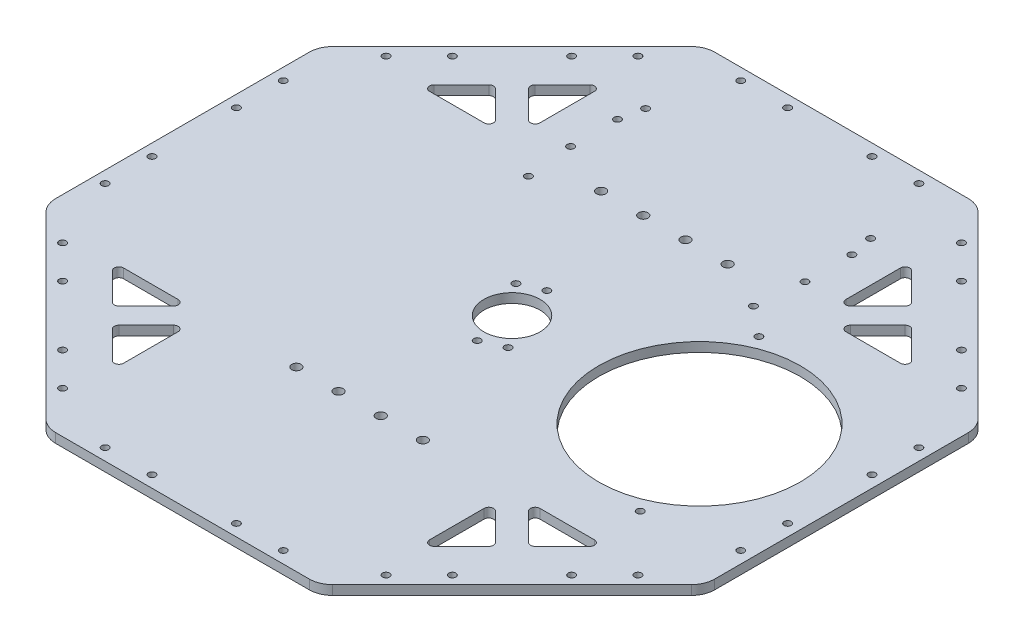
from build123d import *

# Parameters (mm, degrees)
SKETCH_1_R          = 12
SKETCH_1_R_2        = 1.5
EXTRUDE_1_DEPTH     = 4
SKETCH_2_R          = 1.5
SKETCH_2_R_2        = 43
CUT_EXTRUDE_1_DEPTH = 10
SKETCH_3_R          = 1.5
SKETCH_3_R_2        = 2
CUT_EXTRUDE_2_DEPTH = 10
FILLET_3_R          = 10
SKETCH_4_R          = 1.5
CUT_EXTRUDE_3_DEPTH = 10
CUT_EXTRUDE_4_DEPTH = 10
FILLET_4_R          = 2


with BuildPart() as part:
    # 草图1 → 凸台-拉伸1 (new body)
    with BuildSketch(Plane(origin=(0, 0, 0), x_dir=(1, 0, 0), z_dir=(0, 1, 0))):
        Polygon((-140.581929877, 58.23094198), (-58.23094198, 140.581929877), (58.23094198, 140.581929877), (140.581929877, 58.23094198), (140.581929877, -58.23094198), (58.23094198, -140.581929877), (-58.23094198, -140.581929877), (-140.581929877, -58.23094198), align=None)
        with Locations(Location((0, 0, 0), (0, 0, 270))):
            Circle(SKETCH_1_R, mode=Mode.SUBTRACT)
        with Locations(Location((-10.981465686, 12.664726672, 0), (0, 0, 270))):
            Circle(SKETCH_1_R_2, mode=Mode.SUBTRACT)
        with Locations(Location((-1.818534314, 16.663757776, 0), (0, 0, 90))):
            Circle(SKETCH_1_R_2, mode=Mode.SUBTRACT)
        with Locations(Location((1.818534314, -16.663757776, 0), (0, 0, 90))):
            Circle(SKETCH_1_R_2, mode=Mode.SUBTRACT)
        with Locations(Location((10.981465686, -12.664726672, 0), (0, 0, 270))):
            Circle(SKETCH_1_R_2, mode=Mode.SUBTRACT)
    extrude(amount=EXTRUDE_1_DEPTH)

    # 草图2 → 切除-拉伸1 (cut)
    with BuildSketch(Plane(origin=(0, 4, 0), x_dir=(1, 0, 0), z_dir=(0, 1, 0))):
        with Locations(Location((60.4, 44.909241811, 0), (0, 0, 270))):
            Circle(SKETCH_2_R)
        with Locations(Location((99.6, -44.909241811, 0), (0, 0, 270))):
            Circle(SKETCH_2_R)
        with Locations(Location((80, 0, 0), (0, 0, 270))):
            Circle(SKETCH_2_R_2)
    extrude(amount=-CUT_EXTRUDE_1_DEPTH, mode=Mode.SUBTRACT)

    # 草图3 → 切除-拉伸2 (cut)
    with BuildSketch(Plane(origin=(0, 4, 0), x_dir=(1, 0, 0), z_dir=(0, 1, 0))):
        with Locations(Location((-38, 135.581929877, 0), (0, 0, 270))):
            Circle(SKETCH_3_R)
        with Locations(Location((-18, 135.581929877, 0), (0, 0, 270))):
            Circle(SKETCH_3_R)
        with Locations(Location((18, 135.581929877, 0), (0, 0, 90))):
            Circle(SKETCH_3_R)
        with Locations(Location((38, 135.581929877, 0), (0, 0, 90))):
            Circle(SKETCH_3_R)
        with Locations(Location((69.000844337, 122.740959707, 0), (0, 0, 270))):
            Circle(SKETCH_3_R)
        with Locations(Location((83.142979961, 108.598824084, 0), (0, 0, 270))):
            Circle(SKETCH_3_R)
        with Locations(Location((108.598824084, 83.142979961, 0), (0, 0, 90))):
            Circle(SKETCH_3_R)
        with Locations(Location((122.740959707, 69.000844337, 0), (0, 0, 90))):
            Circle(SKETCH_3_R)
        with Locations(Location((135.581929877, 38, 0), (0, 0, 270))):
            Circle(SKETCH_3_R)
        with Locations(Location((135.581929877, 18, 0), (0, 0, 270))):
            Circle(SKETCH_3_R)
        with Locations(Location((135.581929877, -18, 0), (0, 0, 90))):
            Circle(SKETCH_3_R)
        with Locations(Location((135.581929877, -38, 0), (0, 0, 90))):
            Circle(SKETCH_3_R)
        with Locations(Location((122.740959707, -69.000844337, 0), (0, 0, 270))):
            Circle(SKETCH_3_R)
        with Locations(Location((108.598824084, -83.142979961, 0), (0, 0, 270))):
            Circle(SKETCH_3_R)
        with Locations(Location((83.142979961, -108.598824084, 0), (0, 0, 90))):
            Circle(SKETCH_3_R)
        with Locations(Location((69.000844337, -122.740959707, 0), (0, 0, 90))):
            Circle(SKETCH_3_R)
        with Locations(Location((38, -135.581929877, 0), (0, 0, 270))):
            Circle(SKETCH_3_R)
        with Locations(Location((18, -135.581929877, 0), (0, 0, 270))):
            Circle(SKETCH_3_R)
        with Locations(Location((-18, -135.581929877, 0), (0, 0, 90))):
            Circle(SKETCH_3_R)
        with Locations(Location((-38, -135.581929877, 0), (0, 0, 90))):
            Circle(SKETCH_3_R)
        with Locations(Location((-69.000844337, -122.740959707, 0), (0, 0, 270))):
            Circle(SKETCH_3_R)
        with Locations(Location((-83.142979961, -108.598824084, 0), (0, 0, 270))):
            Circle(SKETCH_3_R)
        with Locations(Location((-108.598824084, -83.142979961, 0), (0, 0, 90))):
            Circle(SKETCH_3_R)
        with Locations(Location((-122.740959707, -69.000844337, 0), (0, 0, 90))):
            Circle(SKETCH_3_R)
        with Locations(Location((-135.581929877, -38, 0), (0, 0, 270))):
            Circle(SKETCH_3_R)
        with Locations(Location((-135.581929877, -18, 0), (0, 0, 270))):
            Circle(SKETCH_3_R)
        with Locations(Location((-135.581929877, 18, 0), (0, 0, 90))):
            Circle(SKETCH_3_R)
        with Locations(Location((-135.581929877, 38, 0), (0, 0, 90))):
            Circle(SKETCH_3_R)
        with Locations(Location((-122.740959707, 69.000844337, 0), (0, 0, 270))):
            Circle(SKETCH_3_R)
        with Locations(Location((-108.598824084, 83.142979961, 0), (0, 0, 270))):
            Circle(SKETCH_3_R)
        with Locations(Location((-83.142979961, 108.598824084, 0), (0, 0, 90))):
            Circle(SKETCH_3_R)
        with Locations(Location((-69.000844337, 122.740959707, 0), (0, 0, 90))):
            Circle(SKETCH_3_R)
        with Locations(Location((-27, 65, 0), (0, 0, 270))):
            Circle(SKETCH_3_R_2)
        with Locations(Location((-9, 65, 0), (0, 0, 270))):
            Circle(SKETCH_3_R_2)
        with Locations(Location((9, 65, 0), (0, 0, 90))):
            Circle(SKETCH_3_R_2)
        with Locations(Location((27, 65, 0), (0, 0, 90))):
            Circle(SKETCH_3_R_2)
        with Locations(Location((27, -65, 0), (0, 0, 270))):
            Circle(SKETCH_3_R_2)
        with Locations(Location((9, -65, 0), (0, 0, 270))):
            Circle(SKETCH_3_R_2)
        with Locations(Location((-9, -65, 0), (0, 0, 90))):
            Circle(SKETCH_3_R_2)
        with Locations(Location((-27, -65, 0), (0, 0, 90))):
            Circle(SKETCH_3_R_2)
    extrude(amount=-CUT_EXTRUDE_2_DEPTH, mode=Mode.SUBTRACT)

    # 圆角3
    fillet_3_edges = [part.edges().sort_by_distance(p)[0] for p in [
        (-140.581929877, 2, -58.23094198),
        (-58.23094198, 2, -140.581929877),
        (58.23094198, 2, -140.581929877),
        (140.581929877, 2, -58.23094198),
        (140.581929877, 2, 58.23094198),
        (58.23094198, 2, 140.581929877),
        (-58.23094198, 2, 140.581929877),
        (-140.581929877, 2, 58.23094198),
    ]]
    fillet(fillet_3_edges, radius=FILLET_3_R)

    # 草图4 → 切除-拉伸3 (cut)
    with BuildSketch(Plane.XZ):
        with Locations(Location((-50, -75, 0), (0, 0, 270))):
            Circle(SKETCH_4_R)
        with Locations(Location((-50, -95, 0), (0, 0, 270))):
            Circle(SKETCH_4_R)
        with Locations(Location((50, -95, 0), (0, 0, 270))):
            Circle(SKETCH_4_R)
        with Locations(Location((50, -75, 0), (0, 0, 270))):
            Circle(SKETCH_4_R)
        with Locations(Location((-48, -55, 0), (0, 0, 270))):
            Circle(SKETCH_4_R)
        with Locations(Location((48, -55, 0), (0, 0, 270))):
            Circle(SKETCH_4_R)
        with Locations(Location((-48, -105, 0), (0, 0, 270))):
            Circle(SKETCH_4_R)
        with Locations(Location((48, -105, 0), (0, 0, 270))):
            Circle(SKETCH_4_R)
    extrude(amount=-CUT_EXTRUDE_3_DEPTH, mode=Mode.SUBTRACT)

    # 草图5 → 切除-拉伸4 (cut)
    with BuildSketch(Plane.XZ):
        Polygon((65.264300304, -72.335368116), (65.264300304, -105.264300304), (81.728766398, -88.79983421), align=None)
        Polygon((105.264300304, -65.264300304), (72.335368116, -65.264300304), (88.79983421, -81.728766398), align=None)
        Polygon((65.264300304, 72.335368116), (81.728766398, 88.79983421), (65.264300304, 105.264300304), align=None)
        Polygon((88.79983421, 81.728766398), (105.264300304, 65.264300304), (72.335368116, 65.264300304), align=None)
        Polygon((-105.264300304, 65.264300304), (-72.335368116, 65.264300304), (-88.79983421, 81.728766398), align=None)
        Polygon((-65.264300304, 72.335368116), (-65.264300304, 105.264300304), (-81.728766398, 88.79983421), align=None)
        Polygon((-88.79983421, -81.728766398), (-105.264300304, -65.264300304), (-72.335368116, -65.264300304), align=None)
        Polygon((-65.264300304, -72.335368116), (-81.728766398, -88.79983421), (-65.264300304, -105.264300304), align=None)
    extrude(amount=-CUT_EXTRUDE_4_DEPTH, mode=Mode.SUBTRACT)

    # 圆角4
    fillet_4_edges = [part.edges().sort_by_distance(p)[0] for p in [
        (-105.264300304, 2, -65.264300304),
        (-72.335368116, 2, -65.264300304),
        (-88.79983421, 2, -81.728766398),
        (72.335368116, 2, 65.264300304),
        (88.79983421, 2, 81.728766398),
        (105.264300304, 2, 65.264300304),
        (65.264300304, 2, 72.335368116),
        (65.264300304, 2, 105.264300304),
        (81.728766398, 2, 88.79983421),
        (105.264300304, 2, -65.264300304),
        (88.79983421, 2, -81.728766398),
        (72.335368116, 2, -65.264300304),
        (-65.264300304, 2, 72.335368116),
        (-81.728766398, 2, 88.79983421),
        (-65.264300304, 2, 105.264300304),
        (-65.264300304, 2, -72.335368116),
        (-65.264300304, 2, -105.264300304),
        (-81.728766398, 2, -88.79983421),
        (-105.264300304, 2, 65.264300304),
        (-88.79983421, 2, 81.728766398),
        (-72.335368116, 2, 65.264300304),
        (81.728766398, 2, -88.79983421),
        (65.264300304, 2, -105.264300304),
        (65.264300304, 2, -72.335368116),
    ]]
    fillet(fillet_4_edges, radius=FILLET_4_R)


solid = part.part
